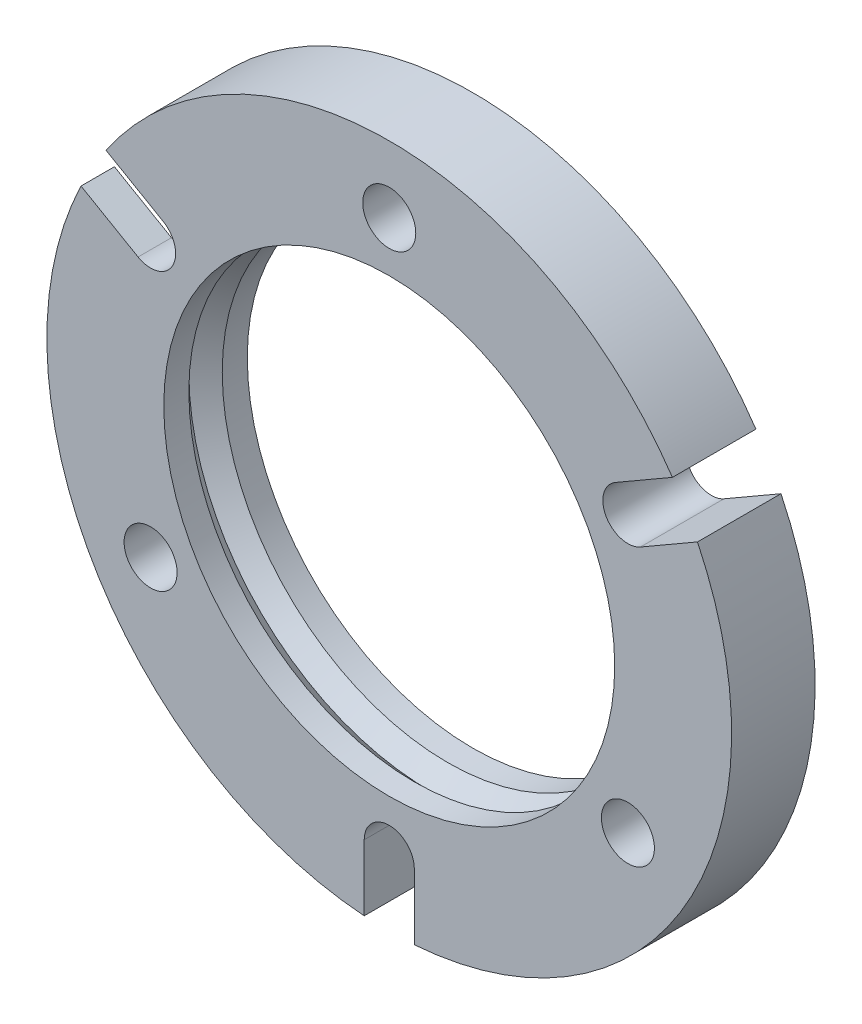
from build123d import *

# Parameters (mm, degrees)
SKETCH1_R          = 20.5
SKETCH1_R_2        = 13.5
SKETCH1_R_3        = 1.5875
EXTRUDE1_DEPTH     = 5
CUT_EXTRUDE1_DEPTH = 30.419381367
CIRPATTERN1_COUNT  = 3
CUT_EXTRUDE2_DEPTH = 3


with BuildPart() as part:
    # Sketch1 → Extrude1 (new body)
    with BuildSketch(Plane.XY):
        Circle(SKETCH1_R)
        Circle(SKETCH1_R_2, mode=Mode.SUBTRACT)
        with Locations((0, 16.5)):
            Circle(SKETCH1_R_3, mode=Mode.SUBTRACT)
        with Locations((14.289419162, -8.25)):
            Circle(SKETCH1_R_3, mode=Mode.SUBTRACT)
        with Locations((-14.289419162, -8.25)):
            Circle(SKETCH1_R_3, mode=Mode.SUBTRACT)
    extrude(amount=EXTRUDE1_DEPTH)

    # Sketch2 → Cut-Extrude1 (cut, through all)
    with BuildSketch(Plane.XY.offset(5)):
        with BuildLine():
            ThreePointArc((1.5, -16.5), (0, -15), (-1.5, -16.5))
            Line((-1.5, -16.5), (-1.5, -20.4450483))
            ThreePointArc((-1.5, -20.4450483), (0, -20.5), (1.5, -20.4450483))
            Line((1.5, -20.4450483), (1.5, -16.5))
        make_face()
    cut_extrude1 = extrude(amount=-CUT_EXTRUDE1_DEPTH, mode=Mode.SUBTRACT)

    # Sketch4 → Cut-Revolve3 (revolve, cut)
    with BuildSketch(Plane(origin=(0, 0, 0), x_dir=(1, 0, 0), z_dir=(0, 1, 0))):
        Polygon((-13.5, -1.5), (-14.5, -2.5), (-13.5, -3.5), align=None)
    revolve(axis=Axis((0, 0, 0), (0, 0, 1)), mode=Mode.SUBTRACT)

    # CirPattern1: Cut-Extrude1 ×3 about axis
    cirpattern1_axis = Axis((0, 0, 5), (0, 0, -1))
    for i in range(1, CIRPATTERN1_COUNT):
        add(cut_extrude1.rotate(cirpattern1_axis, i * 360 / CIRPATTERN1_COUNT), mode=Mode.SUBTRACT)

    # Sketch5 → Cut-Extrude2 (cut)
    with BuildSketch(Plane(origin=(0, 0, 0), x_dir=(-1, 0, 0), z_dir=(0, 0, -1))):
        with BuildLine():
            Line((12.903599864, 7.675974851), (14.551956835, 3.696489096))
            ThreePointArc((14.551956835, 3.696489096), (15.24393144, 2.940634723), (16.259744852, 2.805476312))
            Line((16.259744852, 2.805476312), (20.169765215, 3.664774367))
            ThreePointArc((20.169765215, 3.664774367), (19.491013781, 6.352195037), (18.45593121, 8.923486044))
            Line((18.45593121, 8.923486044), (15.039419162, 6.950961894))
            ThreePointArc((15.039419162, 6.950961894), (13.807259964, 6.829604806), (12.903599864, 7.675974851))
        make_face()
    extrude(amount=-CUT_EXTRUDE2_DEPTH, mode=Mode.SUBTRACT)


solid = part.part
